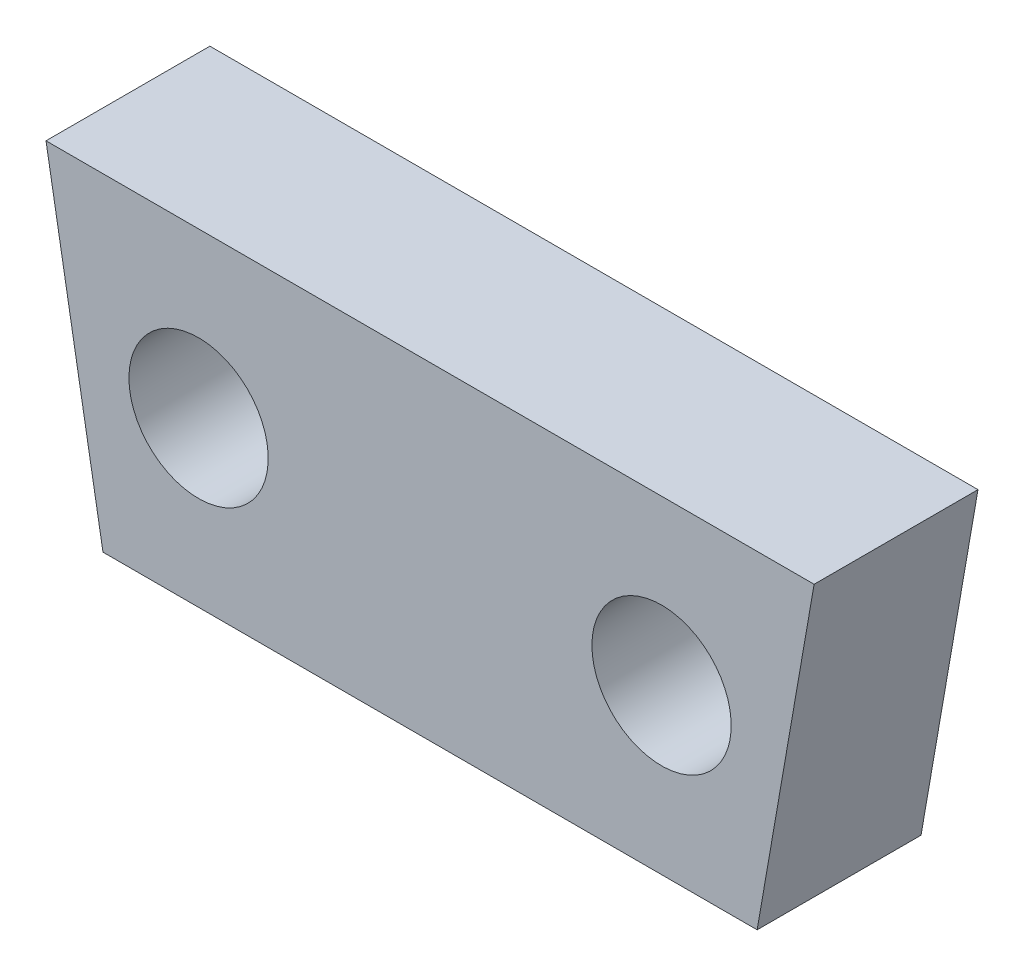
from build123d import *

# Parameters (mm, degrees)
BOSS_EXTRUDE1_DEPTH  = 4
M3_CLEARANCE_HOLE1_D = 3.4


with BuildPart() as part:
    # Sketch1 → Boss-Extrude1 (new body)
    with BuildSketch(Plane(origin=(0, 0, 0), x_dir=(1, 0, 0), z_dir=(0, 0, -1))):
        Polygon((7.983167098, 4), (-7.983167098, 4), (-9.373626011, -4), (9.373626011, -4), align=None)
    extrude(amount=BOSS_EXTRUDE1_DEPTH)

    # M3 Clearance Hole1 (through all)
    with Locations(Plane(origin=(0, 0, -4), x_dir=(-1, 0, 0), z_dir=(0, 0, -1))):
        with Locations((-5.65, 0), (5.65, 0)):
            Hole(M3_CLEARANCE_HOLE1_D / 2)


solid = part.part
